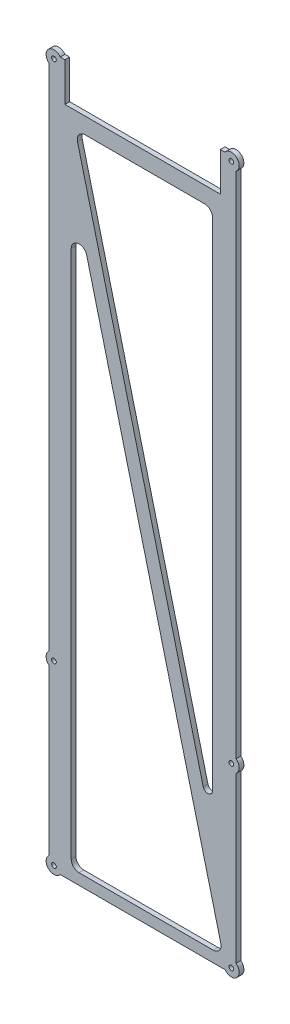
from build123d import *

# Parameters (mm, degrees)
SKETCH_1_R      = 1.5
EXTRUDE_1_DEPTH = 3


with BuildPart() as part:
    # 草图1 → 凸台-拉伸1 (new body)
    with BuildSketch(Plane.XY):
        with BuildLine():
            Line((116, -441), (116, -336.18))
            ThreePointArc((116, -336.18), (118, -332.18), (116, -328.18))
            Line((116, -328.18), (116, -4))
            ThreePointArc((116, -4), (116.535533906, 3.535533906), (109, 3))
            Line((109, 3), (106, 3))
            Line((106, 3), (106, -21.645755349))
            Line((106, -21.645755349), (7, -21.645755349))
            Line((7, -21.645755349), (7, 3))
            Line((7, 3), (4, 3))
            ThreePointArc((4, 3), (-3.535533906, 3.535533906), (-3, -4))
            Line((-3, -4), (-3, -328.18))
            ThreePointArc((-3, -328.18), (-5, -332.18), (-3, -336.18))
            Line((-3, -336.18), (-3, -441))
            ThreePointArc((-3, -441), (-3.535533906, -448.535533906), (4, -448))
            Line((4, -448), (109, -448))
            ThreePointArc((109, -448), (116.535533906, -448.535533906), (116, -441))
        make_face()
        Circle(SKETCH_1_R, mode=Mode.SUBTRACT)
        with Locations((113, 0)):
            Circle(SKETCH_1_R, mode=Mode.SUBTRACT)
        with Locations((113, -445)):
            Circle(SKETCH_1_R, mode=Mode.SUBTRACT)
        with Locations((0, -445)):
            Circle(SKETCH_1_R, mode=Mode.SUBTRACT)
        with Locations((0, -332.18)):
            Circle(SKETCH_1_R, mode=Mode.SUBTRACT)
        with Locations((113, -332.18)):
            Circle(SKETCH_1_R, mode=Mode.SUBTRACT)
        with BuildLine():
            Line((101, -37), (101, -353.3033361))
            ThreePointArc((101, -353.3033361), (98.371573189, -356.280236059), (95.092044423, -354.040760242))
            Line((95.092044423, -354.040760242), (15.005818776, -38.229040236))
            ThreePointArc((15.005818776, -38.229040236), (15.906197954, -33.929592957), (19.852411404, -32))
            Line((19.852411404, -32), (96, -32))
            ThreePointArc((96, -32), (99.535533906, -33.464466094), (101, -37))
        make_face(mode=Mode.SUBTRACT)
        with BuildLine():
            Line((20.846592628, -97.875461369), (106.279422364, -434.770959764))
            ThreePointArc((106.279422364, -434.770959764), (105.379043186, -439.070407043), (101.432829737, -441))
            Line((101.432829737, -441), (16, -441))
            ThreePointArc((16, -441), (12.464466094, -439.535533906), (11, -436))
            Line((11, -436), (11, -99.104501604))
            ThreePointArc((11, -99.104501604), (15.380711351, -94.143001673), (20.846592628, -97.875461369))
        make_face(mode=Mode.SUBTRACT)
    extrude(amount=EXTRUDE_1_DEPTH)


solid = part.part
